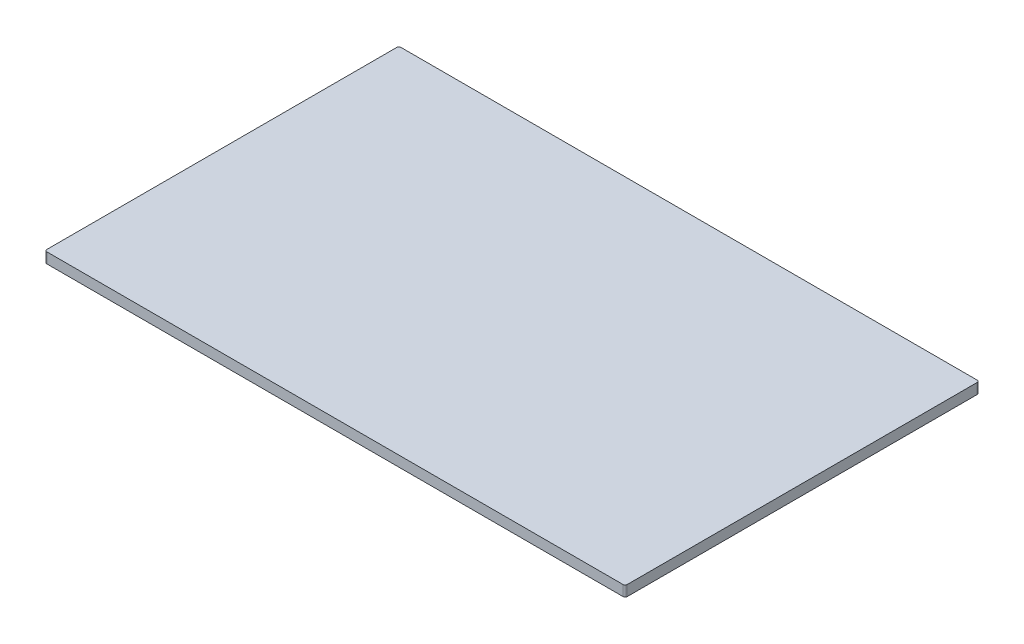
from build123d import *

# Parameters (mm, degrees)
SKETCH1_W           = 554
SKETCH1_H           = 338
BOSS_EXTRUDE1_DEPTH = 10
FILLET1_R           = 2


with BuildPart() as part:
    # Sketch1 → Boss-Extrude1 (new body)
    with BuildSketch(Plane(origin=(0, 0, 0), x_dir=(1, 0, 0), z_dir=(0, 1, 0))):
        Rectangle(SKETCH1_W, SKETCH1_H)
    extrude(amount=BOSS_EXTRUDE1_DEPTH)

    # Fillet1
    fillet1_edges = [part.edges().sort_by_distance(p)[0] for p in [
        (-277, 5, -169),
        (277, 5, -169),
        (277, 5, 169),
        (-277, 5, 169),
    ]]
    fillet(fillet1_edges, radius=FILLET1_R)


solid = part.part
